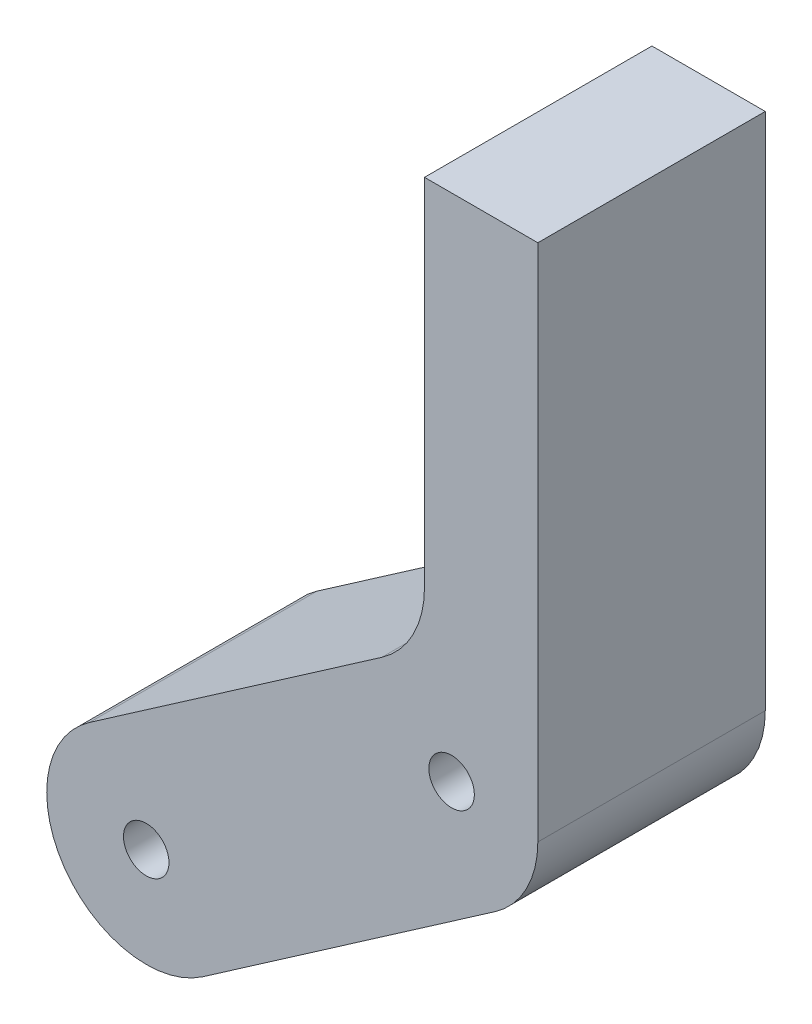
from build123d import *

# Parameters (mm, degrees)
EXTRUDE_1_DEPTH          = 22
CUT_EXTRUDE_START        = -4
CUT_EXTRUDE_1_DEPTH      = 4
SKETCH_3_W               = 2
SKETCH_3_H               = 1.5
CUT_EXTRUDE_2_DEPTH      = 5
FILLET_1_R               = 7
CUT_EXTRUDE_3_DEPTH      = 55.478956816
CUT_EXTRUDE_3_DEPTH_BACK = 55.478956816
SKETCH_11_W              = 74.866363777
SKETCH_11_H              = 10.751937883
CUT_EXTRUDE_4_DEPTH      = 43.459689965
CUT_EXTRUDE_4_DEPTH_BACK = 43.459689965
SKETCH_12_R              = 1.6


with BuildPart() as part:
    # 草图1 → 凸台-拉伸1 (new body)
    with BuildSketch(Plane.XY.offset(11)):
        with BuildLine():
            Line((22.242183112, 32.436253827), (14.268783679, 32.436253827))
            Line((14.268783679, 32.436253827), (14.268783679, 3.77031158))
            Line((14.268783679, 3.77031158), (-9.293805711, -12.555760396))
            ThreePointArc((-9.293805711, -12.555760396), (-11.060906945, -22.296261062), (-1.320406278, -24.063362296))
            Line((-1.320406278, -24.063362296), (22.242183112, -7.73729032))
            Line((22.242183112, -7.73729032), (22.242183112, 32.436253827))
        make_face()
    extrude(amount=-EXTRUDE_1_DEPTH)

    # 草图2 → 切除-拉伸1 (cut)
    with BuildSketch(Plane(origin=(0, 0, -11), x_dir=(-1, 0, 0), z_dir=(0, 0, -1)).offset(CUT_EXTRUDE_START)):
        with BuildLine():
            Line((6.652022195, -14.542440374), (-11.373854522, -8.10694393))
            Line((-11.373854522, -8.10694393), (-11.878198097, -9.519614294))
            Line((-11.878198097, -9.519614294), (3.206970754, -14.905235866))
            ThreePointArc((3.206970754, -14.905235866), (1.308519825, -18.203219238), (3.028991871, -21.597447603))
            Line((3.028991871, -21.597447603), (1.320406278, -24.063362296))
            ThreePointArc((1.320406278, -24.063362296), (8.554651374, -24.510645848), (12.307105995, -18.309561346))
            Line((12.307105995, -18.309561346), (9.307105995, -18.309561346))
            ThreePointArc((9.307105995, -18.309561346), (8.576636909, -16.005181256), (6.652022195, -14.542440374))
        make_face()
    extrude(amount=CUT_EXTRUDE_1_DEPTH, mode=Mode.SUBTRACT)

    # 草图3 → 切除-拉伸2 (cut)
    with BuildSketch(Plane(origin=(7.520945342, 2.685085323, 0), x_dir=(0, 0, 1), z_dir=(-0.9417802429021499, -0.3362290500227003, 0))):
        with Locations((-8, -12.209179925)):
            Rectangle(SKETCH_3_W, SKETCH_3_H)
    extrude(amount=-CUT_EXTRUDE_2_DEPTH, mode=Mode.SUBTRACT)

    # 圆角1
    fillet_1_edges = [part.edges().sort_by_distance(p)[0] for p in [
        (22.242183112, -7.73729032, 0),
        (14.268783679, 3.77031158, 0),
    ]]
    fillet(fillet_1_edges, radius=FILLET_1_R)

    # 草图11 → 切除-拉伸3 (cut, two sides: drawn at the far end of the back side and taken through both)
    with BuildSketch(Plane(origin=(10.836641759, -15.639973933, 0), x_dir=(0.8219715642635482, 0.5695285309289919, 0), z_dir=(0.5695285309289919, -0.8219715642635482, 0)).offset(-CUT_EXTRUDE_3_DEPTH_BACK)):
        with Locations((13.262652651, 10.375968942)):
            Rectangle(SKETCH_11_W, SKETCH_11_H)
    extrude(amount=CUT_EXTRUDE_3_DEPTH + CUT_EXTRUDE_3_DEPTH_BACK, mode=Mode.SUBTRACT)

    # 草图12 → 切除-拉伸4 (cut, two sides: drawn at the far end of the back side and taken through both)
    with BuildSketch(Plane.XY.offset(5).offset(-CUT_EXTRUDE_4_DEPTH_BACK)):
        with Locations(Location((-5.307105995, -18.309561346, 0), (0, 0, 180))):
            Circle(SKETCH_12_R)
        with Locations((16.17499904, -3.425017581)):
            Circle(SKETCH_12_R)
    extrude(amount=CUT_EXTRUDE_4_DEPTH + CUT_EXTRUDE_4_DEPTH_BACK, mode=Mode.SUBTRACT)


solid = part.part
